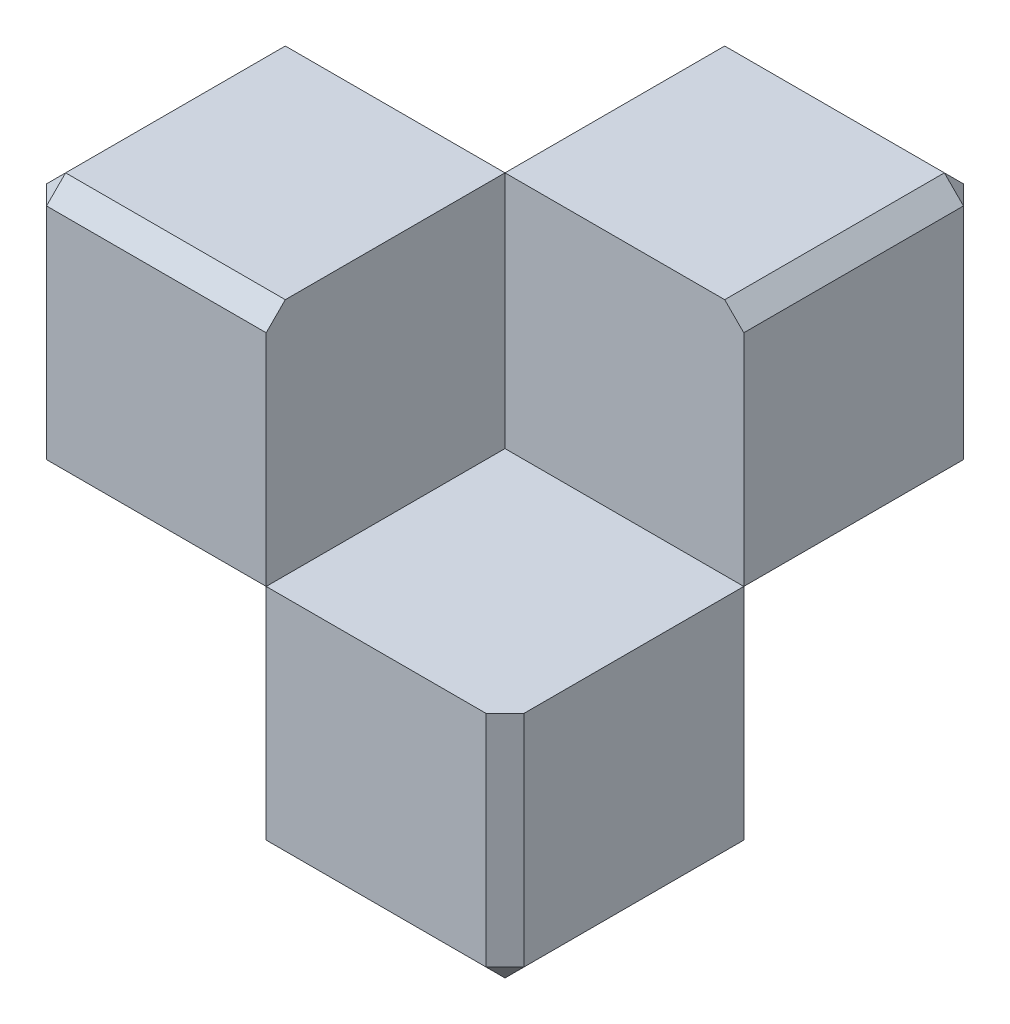
from build123d import *

# Parameters (mm, degrees)
SKETCH1_W             = 25
SKETCH1_H             = 25
BOSS_EXTRUDE1_DEPTH   = 25
BOSS_EXTRUDE1_2_DEPTH = 25
SKETCH2_W             = 25
SKETCH2_H             = 25
BOSS_EXTRUDE2_DEPTH   = 25
BOSS_EXTRUDE2_2_DEPTH = 25
CHAMFER1_SIZE         = 2
CHAMFER2_SIZE         = 2
CHAMFER3_SIZE         = 2
CHAMFER4_SIZE         = 2


with BuildPart() as part:
    # Sketch1 → Boss-Extrude1 (new body)
    with BuildSketch(Plane.XY):
        with Locations((-12.5, -12.5)):
            Rectangle(SKETCH1_W, SKETCH1_H)
    extrude(amount=BOSS_EXTRUDE1_DEPTH)

    # Chamfer3
    chamfer3_edges = [part.edges().sort_by_distance(p)[0] for p in [
        (-12.5, -25, 0),
        (-25, -12.5, 0),
        (-25, -25, 12.5),
    ]]
    chamfer(chamfer3_edges, length=CHAMFER3_SIZE)


with BuildPart() as body_2:
    # Sketch1 → Boss-Extrude1 2 (new body)
    with BuildSketch(Plane.XY):
        with Locations((12.5, 12.5)):
            Rectangle(SKETCH1_W, SKETCH1_H)
    extrude(amount=BOSS_EXTRUDE1_2_DEPTH)

    # Chamfer1
    chamfer1_edges = [body_2.edges().sort_by_distance(p)[0] for p in [
        (12.5, 25, 0),
        (25, 12.5, 0),
        (25, 25, 12.5),
    ]]
    chamfer(chamfer1_edges, length=CHAMFER1_SIZE)


with BuildPart() as body_3:
    # Sketch2 → Boss-Extrude2 (new body)
    with BuildSketch(Plane.XY.offset(25)):
        with Locations((-12.5, 12.5)):
            Rectangle(SKETCH2_W, SKETCH2_H)
    extrude(amount=BOSS_EXTRUDE2_DEPTH)

    # Chamfer2
    chamfer2_edges = [body_3.edges().sort_by_distance(p)[0] for p in [
        (-12.5, 25, 50),
        (-25, 12.5, 50),
        (-25, 25, 37.5),
    ]]
    chamfer(chamfer2_edges, length=CHAMFER2_SIZE)


with BuildPart() as body_4:
    # Sketch2 → Boss-Extrude2 2 (new body)
    with BuildSketch(Plane.XY.offset(25)):
        with Locations((12.5, -12.5)):
            Rectangle(SKETCH2_W, SKETCH2_H)
    extrude(amount=BOSS_EXTRUDE2_2_DEPTH)

    # Chamfer4
    chamfer4_edges = [body_4.edges().sort_by_distance(p)[0] for p in [
        (12.5, -25, 50),
        (25, -12.5, 50),
        (25, -25, 37.5),
    ]]
    chamfer(chamfer4_edges, length=CHAMFER4_SIZE)


solid = Compound([part.part, body_2.part, body_3.part, body_4.part])
